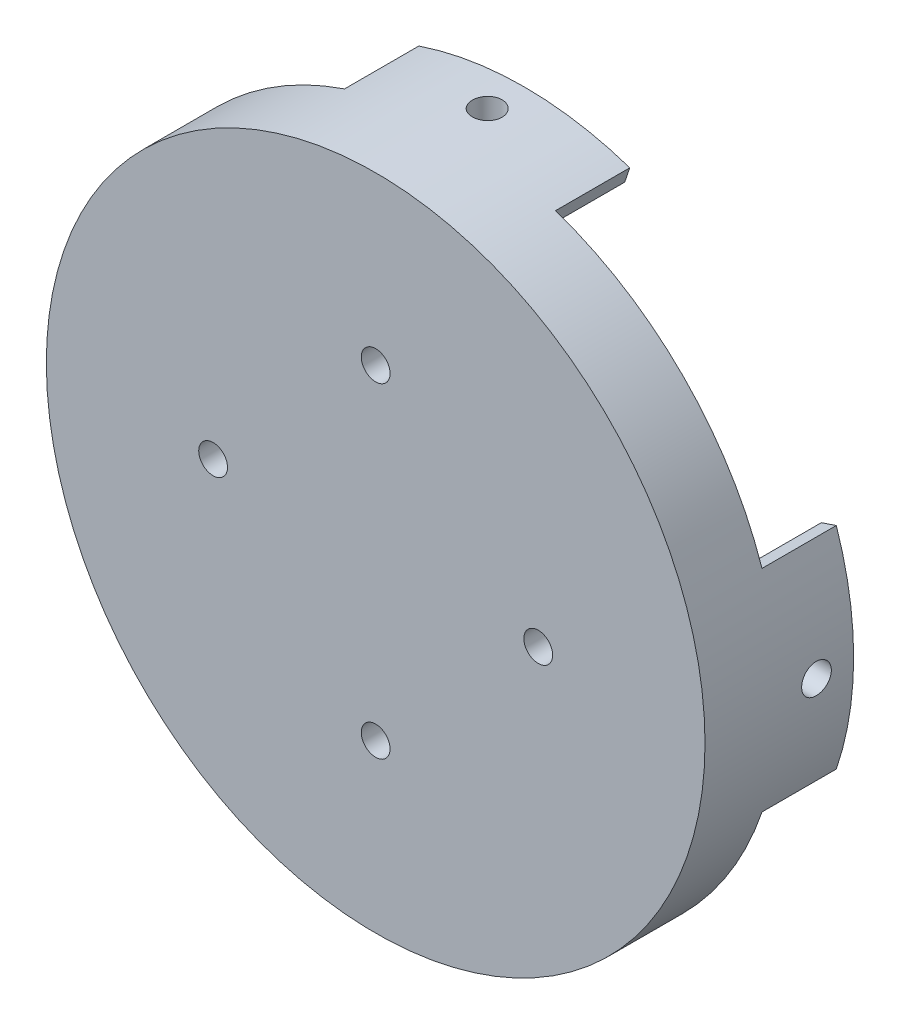
from build123d import *
from build123d.topology import SkipClean

# Parameters (mm, degrees)
SKETCH2_R           = 45.025932087
SKETCH2_R_2         = 1.9685
BOSS_EXTRUDE1_DEPTH = 10.16
SKETCH3_R           = 3.81
CUT_EXTRUDE1_DEPTH  = 3.81
BOSS_EXTRUDE2_START = 10.16
BOSS_EXTRUDE2_DEPTH = 10.16
SKETCH6_R           = 2.032
CUT_EXTRUDE2_DEPTH  = 10.16
CIRPATTERN2_COUNT   = 4


with BuildPart() as part:
    # Sketch2 → Boss-Extrude1 (new body)
    with BuildSketch(Plane.XY):
        Circle(SKETCH2_R)
        with Locations((0, -22.225)):
            Circle(SKETCH2_R_2, mode=Mode.SUBTRACT)
        with Locations((-22.225, 0)):
            Circle(SKETCH2_R_2, mode=Mode.SUBTRACT)
        with Locations((0, 22.225)):
            Circle(SKETCH2_R_2, mode=Mode.SUBTRACT)
        with Locations((22.225, 0)):
            Circle(SKETCH2_R_2, mode=Mode.SUBTRACT)
    extrude(amount=BOSS_EXTRUDE1_DEPTH)

    # Sketch3 → Cut-Extrude1 (cut)
    with BuildSketch(Plane(origin=(0, 0, 0), x_dir=(-1, 0, 0), z_dir=(0, 0, -1))):
        with Locations((0, 22.225)):
            Circle(SKETCH3_R)
        with Locations((22.225, 0)):
            Circle(SKETCH3_R)
        with Locations((0, -22.225)):
            Circle(SKETCH3_R)
        with Locations((-22.225, 0)):
            Circle(SKETCH3_R)
    extrude(amount=-CUT_EXTRUDE1_DEPTH, mode=Mode.SUBTRACT)

    # Sketch5 → Boss-Extrude2 (add)
    with SkipClean():  # the faces are left unmerged after this step: merging them gives an invalid solid
        with BuildSketch(Plane(origin=(0, 0, 0), x_dir=(-1, 0, 0), z_dir=(0, 0, -1)).offset(BOSS_EXTRUDE2_START)):
            with BuildLine():
                Line((41.699931294, 5.08), (41.699931294, -5.08))
                Line((41.699931294, -5.08), (42.560096203, -5.08))
                ThreePointArc((42.560096203, -5.08), (41.806519891, -9.454262714), (40.604604544, -13.727136578))
                Line((40.604604544, -13.727136578), (42.654370672, -14.420097879))
                ThreePointArc((42.654370672, -14.420097879), (45.025932087, 0), (42.654370672, 14.420097879))
                Line((42.654370672, 14.420097879), (40.604604544, 13.727136578))
                ThreePointArc((40.604604544, 13.727136578), (41.806519891, 9.454262714), (42.560096203, 5.08))
                Line((42.560096203, 5.08), (41.699931294, 5.08))
            make_face()
        boss_extrude2 = extrude(amount=-BOSS_EXTRUDE2_DEPTH)

    # Sketch6 → Cut-Extrude2 (cut)
    with SkipClean():  # the faces are left unmerged after this step: merging them gives an invalid solid
        with BuildSketch(Plane(origin=(-41.699931294, 0, 0), x_dir=(0, 0, -1), z_dir=(1, 0, 0))):
            with Locations(Location((5.08, 0, 0), (0, 0, 90))):
                Circle(SKETCH6_R)
        cut_extrude2 = extrude(amount=-CUT_EXTRUDE2_DEPTH, mode=Mode.SUBTRACT)

    # CirPattern2: Boss-Extrude2, Cut-Extrude2 ×4 about axis
    with SkipClean():  # the faces are left unmerged after this step: merging them gives an invalid solid
        cirpattern2_axis = Axis((0, 0, 0), (0, 0, 1))
        add([boss_extrude2.rotate(cirpattern2_axis, i * 360 / CIRPATTERN2_COUNT) for i in range(1, CIRPATTERN2_COUNT)])
        add([cut_extrude2.rotate(cirpattern2_axis, i * 360 / CIRPATTERN2_COUNT) for i in range(1, CIRPATTERN2_COUNT)], mode=Mode.SUBTRACT)


solid = part.part
